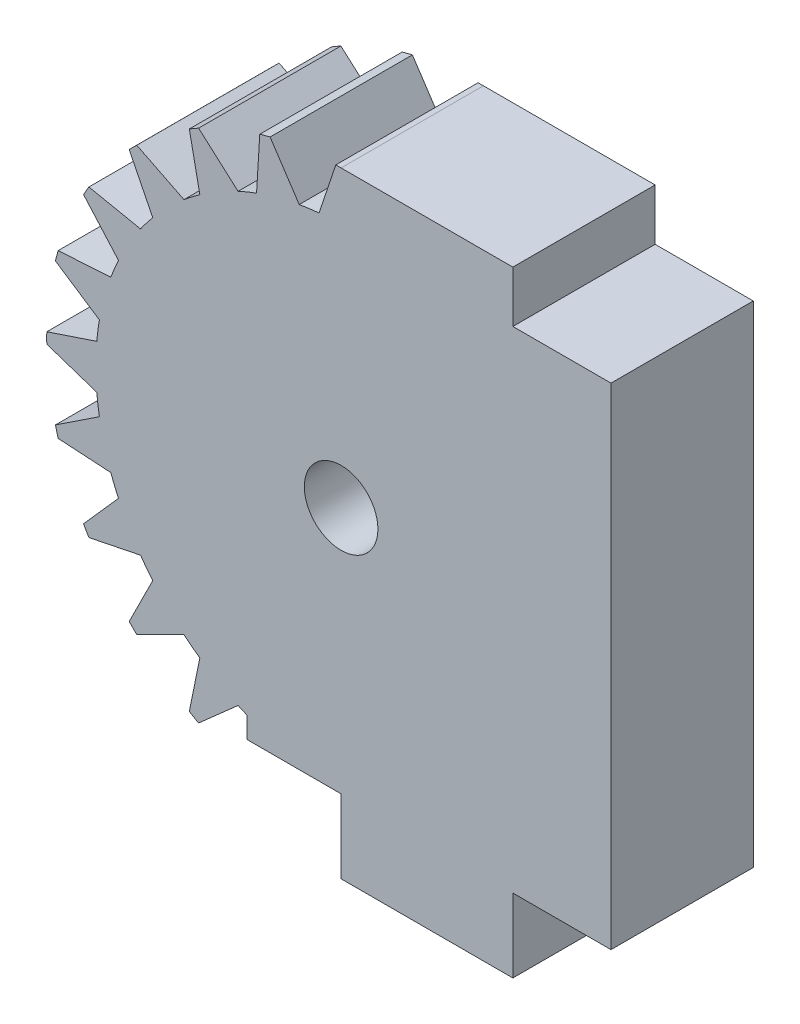
from build123d import *

# Parameters (mm, degrees)
SKETCH1_R           = 10
BOSS_EXTRUDE1_DEPTH = 5.8
BOSS_EXTRUDE2_DEPTH = 5.8
CIRPATTERN1_COUNT   = 24
SKETCH3_R           = 12.65
SKETCH3_R_2         = 12
CUT_EXTRUDE1_DEPTH  = 6
CUT_EXTRUDE2_DEPTH  = 6
SKETCH5_R           = 1.5
CUT_EXTRUDE3_DEPTH  = 6
BOSS_EXTRUDE3_DEPTH = 5.8


with BuildPart() as part:
    # Sketch1 → Boss-Extrude1 (new body)
    with BuildSketch(Plane.XY):
        Circle(SKETCH1_R)
    extrude(amount=BOSS_EXTRUDE1_DEPTH)

    # Sketch2 → Boss-Extrude2 (add)
    with BuildSketch(Plane.XY):
        with BuildLine():
            Line((0, 12.65), (-0.9, 9.959417654))
            ThreePointArc((-0.9, 9.959417654), (0, 10), (0.9, 9.959417654))
            Line((0.9, 9.959417654), (0, 12.65))
        make_face()
    boss_extrude2 = extrude(amount=BOSS_EXTRUDE2_DEPTH)

    # CirPattern1: Boss-Extrude2 ×24 about axis
    cirpattern1_axis = Axis((0, 0, 0), (0, 0, 1))
    for i in range(1, CIRPATTERN1_COUNT):
        add(boss_extrude2.rotate(cirpattern1_axis, i * 360 / CIRPATTERN1_COUNT))

    # Sketch3 → Cut-Extrude1 (cut)
    with BuildSketch(Plane.XY):
        Circle(SKETCH3_R)
        Circle(SKETCH3_R_2, mode=Mode.SUBTRACT)
    extrude(amount=CUT_EXTRUDE1_DEPTH, mode=Mode.SUBTRACT)

    # Sketch4 → Cut-Extrude2 (cut)
    with BuildSketch(Plane.XY):
        with BuildLine():
            Line((0, 0), (0, 12))
            ThreePointArc((0, 12), (11.769423365, -2.341083864), (-4.592201188, -11.08655439))
            Line((-4.592201188, -11.08655439), (-3.826834324, -9.238795325))
            Line((-3.826834324, -9.238795325), (0, 0))
        make_face()
    extrude(amount=CUT_EXTRUDE2_DEPTH, mode=Mode.SUBTRACT)

    # Sketch5 → Cut-Extrude3 (cut)
    with BuildSketch(Plane.XY):
        Circle(SKETCH5_R)
    extrude(amount=CUT_EXTRUDE3_DEPTH, mode=Mode.SUBTRACT)

    # Sketch6 → Boss-Extrude3 (add)
    with BuildSketch(Plane.XY):
        with BuildLine():
            Line((0, 1.5), (0, 12))
            Line((0, 12), (7, 12))
            Line((7, 12), (7, 9.904493766))
            Line((7, 9.904493766), (11, 9.904493766))
            Line((11, 9.904493766), (11, -10.095506234))
            Line((11, -10.095506234), (7, -10.095506234))
            Line((7, -10.095506234), (7, -13.095506234))
            Line((7, -13.095506234), (0, -13.095506234))
            Line((0, -13.095506234), (0, -10.095506234))
            Line((0, -10.095506234), (-3.826834324, -10.095506234))
            Line((-3.826834324, -10.095506234), (-3.826834324, -9.238795325))
            Line((-3.826834324, -9.238795325), (-0.574025149, -1.385819299))
            ThreePointArc((-0.574025149, -1.385819299), (1.471177921, -0.292635483), (0, 1.5))
        make_face()
    extrude(amount=BOSS_EXTRUDE3_DEPTH)


solid = part.part
